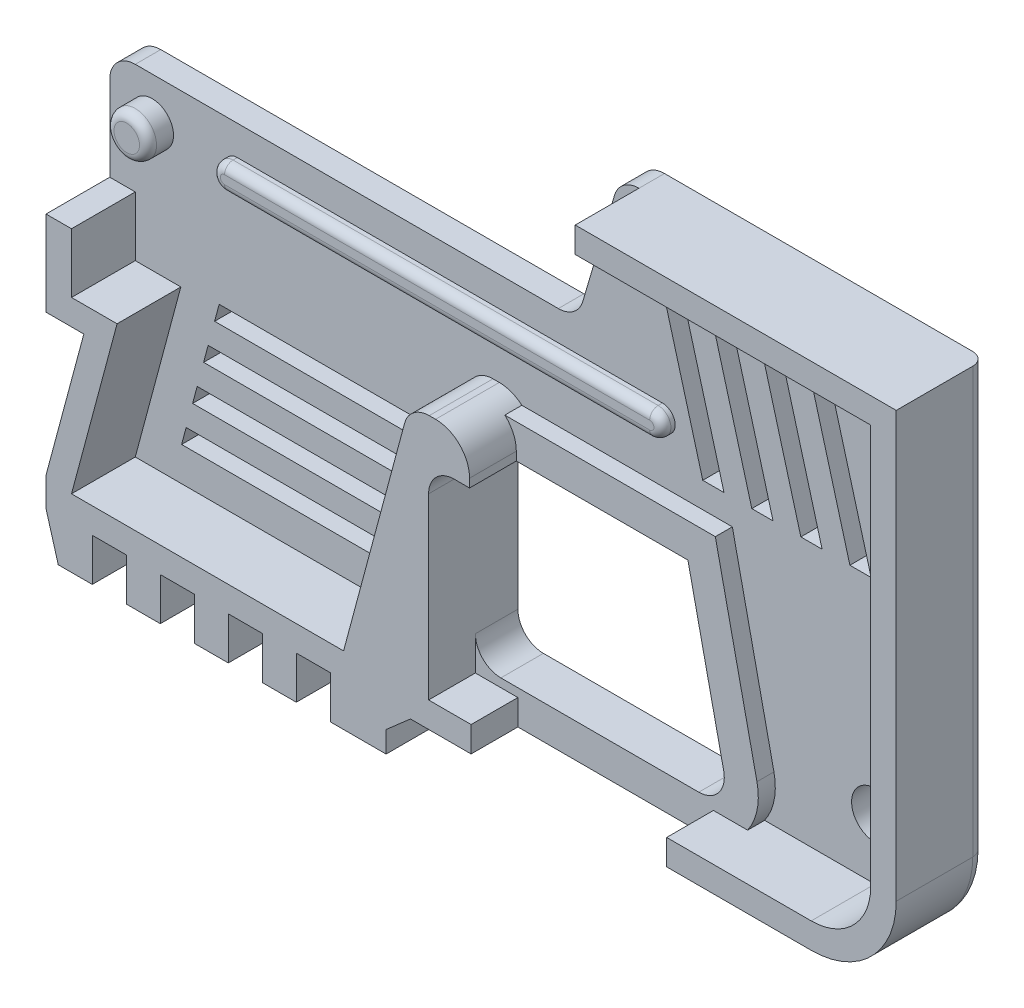
from build123d import *

# Parameters (mm, degrees)
BOSS_EXTRUDE1_DEPTH = 3
CUT_EXTRUDE1_DEPTH  = 70.878465925
BOSS_EXTRUDE2_DEPTH = 7.5
BOSS_EXTRUDE3_START = 2
BOSS_EXTRUDE3_DEPTH = 2
CUT_EXTRUDE2_DEPTH  = 71.215738976
BOSS_EXTRUDE4_DEPTH = 7.5
CUT_EXTRUDE3_DEPTH  = 71.599220959
BOSS_EXTRUDE5_START = 7.5
BOSS_EXTRUDE5_DEPTH = 7.5
SKETCH10_R          = 2.5
BOSS_EXTRUDE6_DEPTH = 3
FILLET2_R           = 1
SKETCH11_R          = 2.75
CUT_EXTRUDE5_DEPTH  = 71.215738976
FILLET3_R           = 1.5
CUT_EXTRUDE6_DEPTH  = 71.215738976
BOSS_EXTRUDE7_DEPTH = 10.5
CHAMFER1_SIZE       = 1
SKETCH14_W          = 4
SKETCH14_H          = 5.009213965
CUT_EXTRUDE7_DEPTH  = 74.75726829
BOSS_EXTRUDE8_DEPTH = 1.5
FILLET4_R           = 1
FILLET5_R           = 4


with BuildPart() as part:
    # Sketch1 → Boss-Extrude1 (new body)
    with BuildSketch(Plane.XY):
        with BuildLine():
            Line((0.633382655, 2.153501028), (4.366617345, 14.846498972))
            ThreePointArc((4.366617345, 14.846498972), (5.447423794, 16.40203007), (7.244713849, 17))
            Line((7.244713849, 17), (45, 17))
            Line((45, 17), (45, -33))
            ThreePointArc((45, -33), (42.071067812, -40.071067812), (35, -43))
            Line((35, -43), (-55, -43))
            Line((-55, -43), (-55, -3))
            ThreePointArc((-55, -3), (-54.121320344, -0.878679656), (-52, 0))
            Line((-52, 0), (-2.244713849, 0))
            ThreePointArc((-2.244713849, 0), (-0.447423794, 0.59796993), (0.633382655, 2.153501028))
        make_face()
    extrude(amount=BOSS_EXTRUDE1_DEPTH)

    # Sketch2 → Cut-Extrude1 (cut, through all)
    with BuildSketch(Plane.XY.offset(3)):
        with BuildLine():
            Line((-7, -16), (15, -16))
            Line((15, -16), (19.209285015, -35.362711067))
            ThreePointArc((19.209285015, -35.362711067), (18.613549878, -37.882569149), (16.277755923, -39))
            Line((16.277755923, -39), (-7, -39))
            ThreePointArc((-7, -39), (-9.121320344, -38.121320344), (-10, -36))
            Line((-10, -36), (-10, -19))
            ThreePointArc((-10, -19), (-9.121320344, -16.878679656), (-7, -16))
        make_face()
    extrude(amount=-CUT_EXTRUDE1_DEPTH, mode=Mode.SUBTRACT)

    # Sketch3 → Boss-Extrude2 (add)
    with BuildSketch(Plane.XY.offset(3)):
        with BuildLine():
            Line((45, -33), (45, 17))
            Line((45, 17), (7.244713849, 17))
            Line((7.244713849, 17), (7.244713849, 14))
            Line((7.244713849, 14), (42, 14))
            Line((42, 14), (42, -33))
            ThreePointArc((42, -33), (39.949747468, -37.949747468), (35, -40))
            Line((35, -40), (18, -40))
            Line((18, -40), (18, -43))
            Line((18, -43), (35, -43))
            ThreePointArc((35, -43), (42.071067812, -40.071067812), (45, -33))
        make_face()
        Polygon((-5, -43), (-55, -43), (-55, -13), (-52, -13), (-52, -40), (-5, -40), align=None)
    extrude(amount=BOSS_EXTRUDE2_DEPTH)

    # Sketch4 → Boss-Extrude3 (add)
    with BuildSketch(Plane.XY.offset(3).offset(BOSS_EXTRUDE3_START)):
        with BuildLine():
            Line((18.223861668, -12), (-7, -12))
            ThreePointArc((-7, -12), (-11.949747468, -14.050252532), (-14, -19))
            Line((-14, -19), (-14, -36))
            ThreePointArc((-14, -36), (-11.949747468, -40.949747468), (-7, -43))
            Line((-7, -43), (16.277755923, -43))
            ThreePointArc((16.277755923, -43), (21.727941817, -40.392661348), (23.11799047, -34.51299249))
            Line((23.11799047, -34.51299249), (18.223861668, -12))
        make_face()
        with BuildLine():
            Line((15, -16), (-7, -16))
            ThreePointArc((-7, -16), (-9.121320344, -16.878679656), (-10, -19))
            Line((-10, -19), (-10, -36))
            ThreePointArc((-10, -36), (-9.121320344, -38.121320344), (-7, -39))
            Line((-7, -39), (16.277755923, -39))
            ThreePointArc((16.277755923, -39), (18.613549878, -37.882569149), (19.209285015, -35.362711067))
            Line((19.209285015, -35.362711067), (15, -16))
        make_face(mode=Mode.SUBTRACT)
    extrude(amount=-BOSS_EXTRUDE3_DEPTH)

    # Sketch5 → Cut-Extrude2 (cut, through all)
    with BuildSketch(Plane.XY.offset(3)):
        Polygon((9.244713849, 11), (14.744713849, -9), (17.244713849, -9), (11.744713849, 11), align=None)
        Polygon((23.012478168, -9), (17.512478168, 11), (15.012478168, 11), (20.512478168, -9), align=None)
        Polygon((28.780242487, -9), (23.280242487, 11), (20.780242487, 11), (26.280242487, -9), align=None)
        Polygon((34.548006805, -9), (29.048006805, 11), (26.548006805, 11), (32.048006805, -9), align=None)
    extrude(amount=-CUT_EXTRUDE2_DEPTH, mode=Mode.SUBTRACT)

    # Sketch6 → Boss-Extrude4 (add)
    with BuildSketch(Plane.XY.offset(3)):
        Polygon((-52, -40), (-46.641016151, -20), (-52, -20), align=None)
    extrude(amount=BOSS_EXTRUDE4_DEPTH)

    # Sketch7 → Cut-Extrude3 (cut, through all)
    with BuildSketch(Plane.XY.offset(10.5)):
        Polygon((-55, -39.605042507), (-55, -23), (-50.55069227, -23), align=None)
    extrude(amount=-CUT_EXTRUDE3_DEPTH, mode=Mode.SUBTRACT)

    # Sketch8 → Boss-Extrude5 (add)
    with BuildSketch(Plane.XY.offset(3).offset(BOSS_EXTRUDE5_START)):
        with BuildLine():
            Line((-10, -40), (-10, -19))
            ThreePointArc((-10, -19), (-9.121320344, -16.878679656), (-7, -16))
            Line((-7, -16), (-5.183058398, -16))
            Line((-5.183058398, -16), (-5.183058398, -11))
            Line((-5.183058398, -11), (-9.927492456, -11))
            ThreePointArc((-9.927492456, -11), (-11.753776743, -11.619939979), (-12.825269934, -13.223542865))
            Line((-12.825269934, -13.223542865), (-20, -40))
            Line((-20, -40), (-10, -40))
        make_face()
    extrude(amount=-BOSS_EXTRUDE5_DEPTH)

    # Sketch10 → Boss-Extrude6 (add)
    with BuildSketch(Plane.XY.offset(3)):
        with Locations(Location((-50, -5, 0), (0, 0, 180))):
            Circle(SKETCH10_R)
    extrude(amount=BOSS_EXTRUDE6_DEPTH)

    # Fillet2
    fillet2_edges = [part.edges().sort_by_distance(p)[0] for p in [
        (-47.5, -5, 6),
    ]]
    fillet(fillet2_edges, radius=FILLET2_R)

    # Sketch11 → Cut-Extrude5 (cut, through all)
    with BuildSketch(Plane.XY.offset(3)):
        with Locations((35, -33)):
            Circle(SKETCH11_R)
    extrude(amount=-CUT_EXTRUDE5_DEPTH, mode=Mode.SUBTRACT)

    # Fillet3
    fillet3_edges = [part.edges().sort_by_distance(p)[0] for p in [
        (45, -8, 0),
        (42.071067812, -40.071067812, 0),
        (-10, -43, 0),
    ]]
    fillet(fillet3_edges, radius=FILLET3_R)

    # Sketch12 → Cut-Extrude6 (cut, through all)
    with BuildSketch(Plane.XY.offset(3)):
        Polygon((-46.551669862, -36), (-22.551669862, -36), (-22.015771477, -34), (-46.015771477, -34), align=None)
        Polygon((-45.257574636, -31.170370869), (-21.257574636, -31.170370869), (-20.721676251, -29.170370869), (-44.721676251, -29.170370869), align=None)
        Polygon((-43.963479411, -26.340741737), (-19.963479411, -26.340741737), (-19.427581026, -24.340741737), (-43.427581026, -24.340741737), align=None)
        Polygon((-42.669384185, -21.511112606), (-18.669384185, -21.511112606), (-18.1334858, -19.511112606), (-42.1334858, -19.511112606), align=None)
    extrude(amount=-CUT_EXTRUDE6_DEPTH, mode=Mode.SUBTRACT)

    # Sketch13 → Boss-Extrude7 (add)
    with BuildSketch(Plane.XY):
        Polygon((-55, -43), (-53.558551653, -48.009213965), (-14.997432238, -48.009213965), (-14.997432238, -45.504606983), (-12.13347642, -43), align=None)
    extrude(amount=BOSS_EXTRUDE7_DEPTH)

    # Chamfer1
    chamfer1_edges = [part.edges().sort_by_distance(p)[0] for p in [
        (-33.56673821, -43, 0),
        (-34.277991946, -48.009213965, 0),
    ]]
    chamfer(chamfer1_edges, length=CHAMFER1_SIZE)

    # Sketch14 → Cut-Extrude7 (cut, through all)
    with BuildSketch(Plane.XY.offset(10.5)):
        with Locations((-47.558551653, -45.504606983)):
            Rectangle(SKETCH14_W, SKETCH14_H)
        with Locations((-39.558551653, -45.504606983)):
            Rectangle(SKETCH14_W, SKETCH14_H)
        with Locations((-31.558551653, -45.504606983)):
            Rectangle(SKETCH14_W, SKETCH14_H)
        with Locations((-23.558551653, -45.504606983)):
            Rectangle(SKETCH14_W, SKETCH14_H)
    extrude(amount=-CUT_EXTRUDE7_DEPTH, mode=Mode.SUBTRACT)

    # Sketch9 → Boss-Extrude8 (add)
    with BuildSketch(Plane.XY.offset(3)):
        with BuildLine():
            Line((-40, -3.5), (10, -3.5))
            ThreePointArc((10, -3.5), (11.5, -5), (10, -6.5))
            Line((10, -6.5), (-40, -6.5))
            ThreePointArc((-40, -6.5), (-41.5, -5), (-40, -3.5))
        make_face()
    extrude(amount=BOSS_EXTRUDE8_DEPTH)

    # Fillet4
    fillet4_edges = [part.edges().sort_by_distance(p)[0] for p in [
        (-41.5, -5, 4.5),
        (-15, -6.5, 4.5),
        (11.5, -5, 4.5),
        (-15, -3.5, 4.5),
    ]]
    fillet(fillet4_edges, radius=FILLET4_R)

    # Fillet5
    fillet5_edges = [part.edges().sort_by_distance(p)[0] for p in [
        (-5.183058398, -11, 6.75),
    ]]
    fillet(fillet5_edges, radius=FILLET5_R)


solid = part.part
